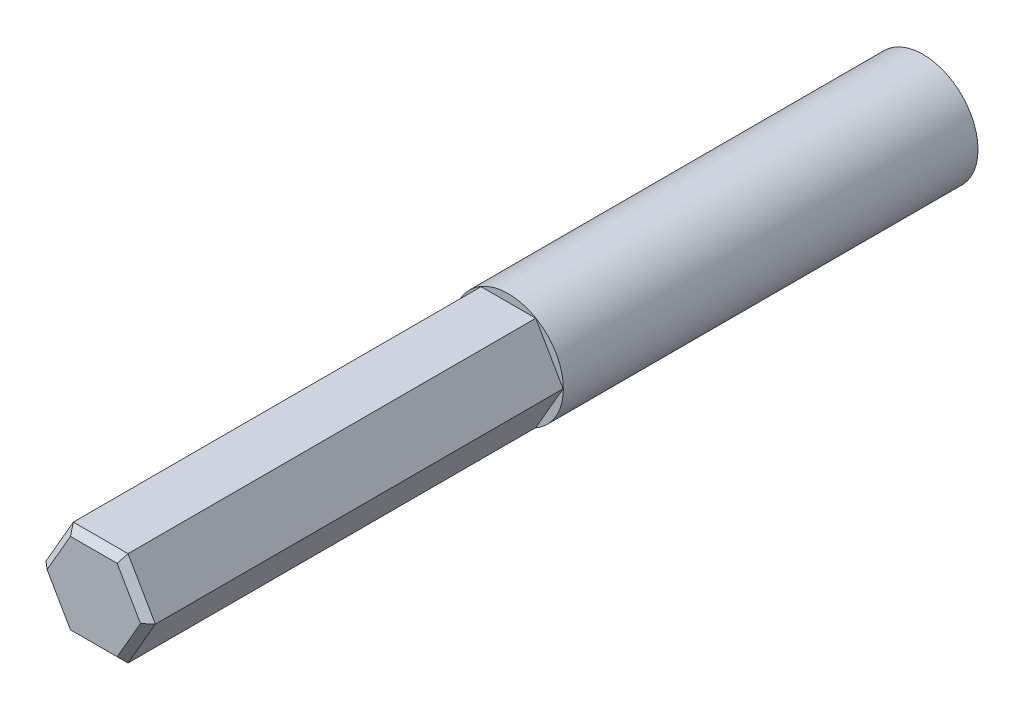
from build123d import *

# Parameters (mm, degrees)
SKETCH1_R           = 3.975
BOSS_EXTRUDE1_DEPTH = 30
BOSS_EXTRUDE2_DEPTH = 30
CHAMFER2_SIZE       = 0.5


with BuildPart() as part:
    # Sketch1 → Boss-Extrude1 (new body)
    with BuildSketch(Plane.XY):
        Circle(SKETCH1_R)
    extrude(amount=BOSS_EXTRUDE1_DEPTH)

    # Sketch2 → Boss-Extrude2 (add)
    with BuildSketch(Plane.XY.offset(30)):
        Polygon((3.95669873, 0), (1.978349365, 3.426601615), (-1.978349365, 3.426601615), (-3.95669873, 0), (-1.978349365, -3.426601615), (1.978349365, -3.426601615), align=None)
    extrude(amount=BOSS_EXTRUDE2_DEPTH)

    # Chamfer2
    chamfer2_edges = [part.edges().sort_by_distance(p)[0] for p in [
        (2.967524047, -1.713300808, 60),
        (2.967524047, 1.713300808, 60),
        (0, 3.426601615, 60),
        (-2.967524047, 1.713300808, 60),
        (-2.967524047, -1.713300808, 60),
        (0, -3.426601615, 60),
    ]]
    chamfer(chamfer2_edges, length=CHAMFER2_SIZE)


solid = part.part
